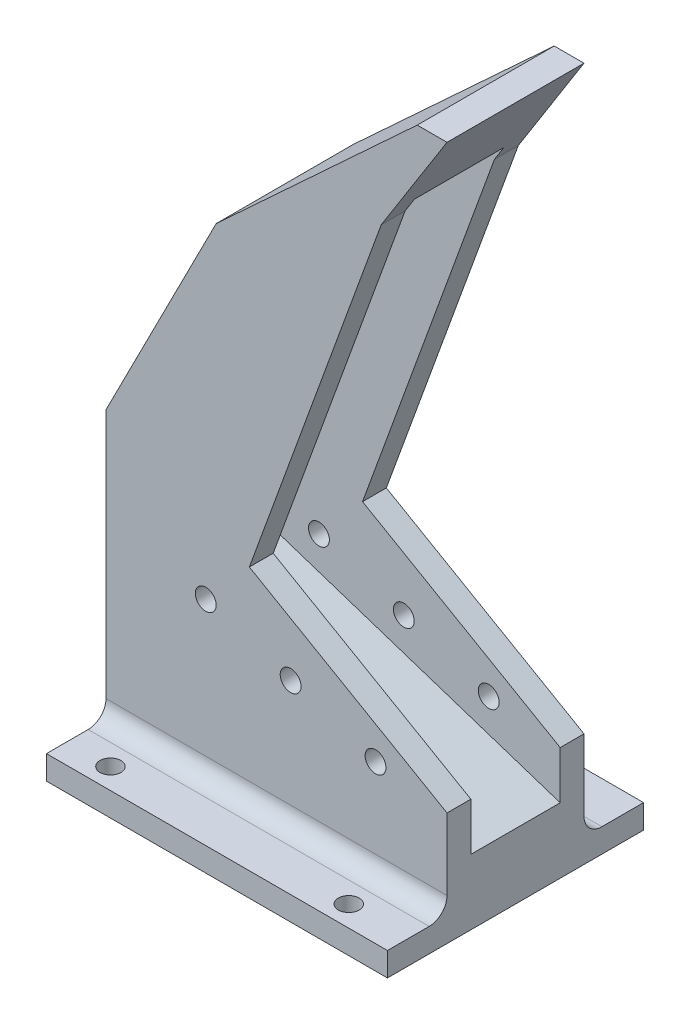
from build123d import *

# Parameters (mm, degrees)
BOSS_EXTRUDE1_DEPTH     = 11.5
SKETCH2_OUTSIDE_W       = 84.912
SKETCH2_OUTSIDE_H       = 140.162
CUT_EXTRUDE2_DEPTH      = 7.5
CUT_EXTRUDE3_DEPTH      = 129.307516771
CUT_EXTRUDE3_DEPTH_BACK = 129.307516771
SKETCH4_R               = 1.75
SKETCH5_W               = 57.250055546
SKETCH5_H               = 43
BOSS_EXTRUDE2_DEPTH     = 4
SKETCH6_R               = 1.75
CUT_EXTRUDE4_DEPTH      = 129.047135306
FILLET1_R               = 3


with BuildPart() as part:
    # Sketch1 → Boss-Extrude1 (new, symmetric)
    with BuildSketch(Plane.XY):
        Polygon((0, 0), (57.250055546, 0), (57.250055546, 15), (24.066011022, 34.158817039), (46.210390637, 95), (57.250055546, 112.5), (52.250055546, 112.5), (18.50330035, 81.314771653), (0, 45), align=None)
    extrude(amount=BOSS_EXTRUDE1_DEPTH, both=True)

    # Sketch2 outside → Cut-Extrude2 (cut, symmetric)
    with BuildSketch(Plane.XY):
        with Locations((28.625, 56.25)):
            Rectangle(SKETCH2_OUTSIDE_W, SKETCH2_OUTSIDE_H)
        Polygon((21.742887775, 78.862062909), (4, 44.039684964), (4, 24.475940791), (57.250055546, 6.97368477), (57.250055546, 0), (0, 0), (0, 45), (18.50330035, 81.314771653), (52.250055546, 112.5), (57.250055546, 112.5), (47.787485624, 97.5), (47.787485624, 102.92976146), align=None, mode=Mode.SUBTRACT)
    extrude(amount=CUT_EXTRUDE2_DEPTH, both=True, mode=Mode.SUBTRACT)

    # Sketch4 → Cut-Extrude3 (cut, two sides: drawn at the far end of the back side and taken through both)
    with BuildSketch(Plane.XY.offset(11.5).offset(-CUT_EXTRUDE3_DEPTH_BACK)):
        with Locations((45.250055546, 16.444166257)):
            Circle(SKETCH4_R)
        with Locations((31.000040397, 21.127868666)):
            Circle(SKETCH4_R)
        with Locations((16.750025248, 25.811571075)):
            Circle(SKETCH4_R)
    extrude(amount=CUT_EXTRUDE3_DEPTH + CUT_EXTRUDE3_DEPTH_BACK, mode=Mode.SUBTRACT)

    # Sketch5 → Boss-Extrude2 (add)
    with BuildSketch(Plane.XZ):
        with Locations((28.625027773, 0)):
            Rectangle(SKETCH5_W, SKETCH5_H)
    extrude(amount=BOSS_EXTRUDE2_DEPTH)

    # Sketch6 → Cut-Extrude4 (cut, symmetric)
    with BuildSketch(Plane(origin=(0, 0, 0), x_dir=(1, 0, 0), z_dir=(0, 1, 0))):
        with Locations(Location((7.250055546, 18, 0), (0, 0, 270))):
            Circle(SKETCH6_R)
        with Locations(Location((47.250055546, 18, 0), (0, 0, 270))):
            Circle(SKETCH6_R)
    cut_extrude4 = extrude(amount=CUT_EXTRUDE4_DEPTH, both=True, mode=Mode.SUBTRACT)

    # Mirror5: Cut-Extrude4 across plane
    add(cut_extrude4.mirror(Plane.XY), mode=Mode.SUBTRACT)

    # Fillet1
    fillet1_edges = [part.edges().sort_by_distance(p)[0] for p in [
        (28.625027773, 0, -11.5),
        (28.625027773, 0, 11.5),
    ]]
    fillet(fillet1_edges, radius=FILLET1_R)


solid = part.part
